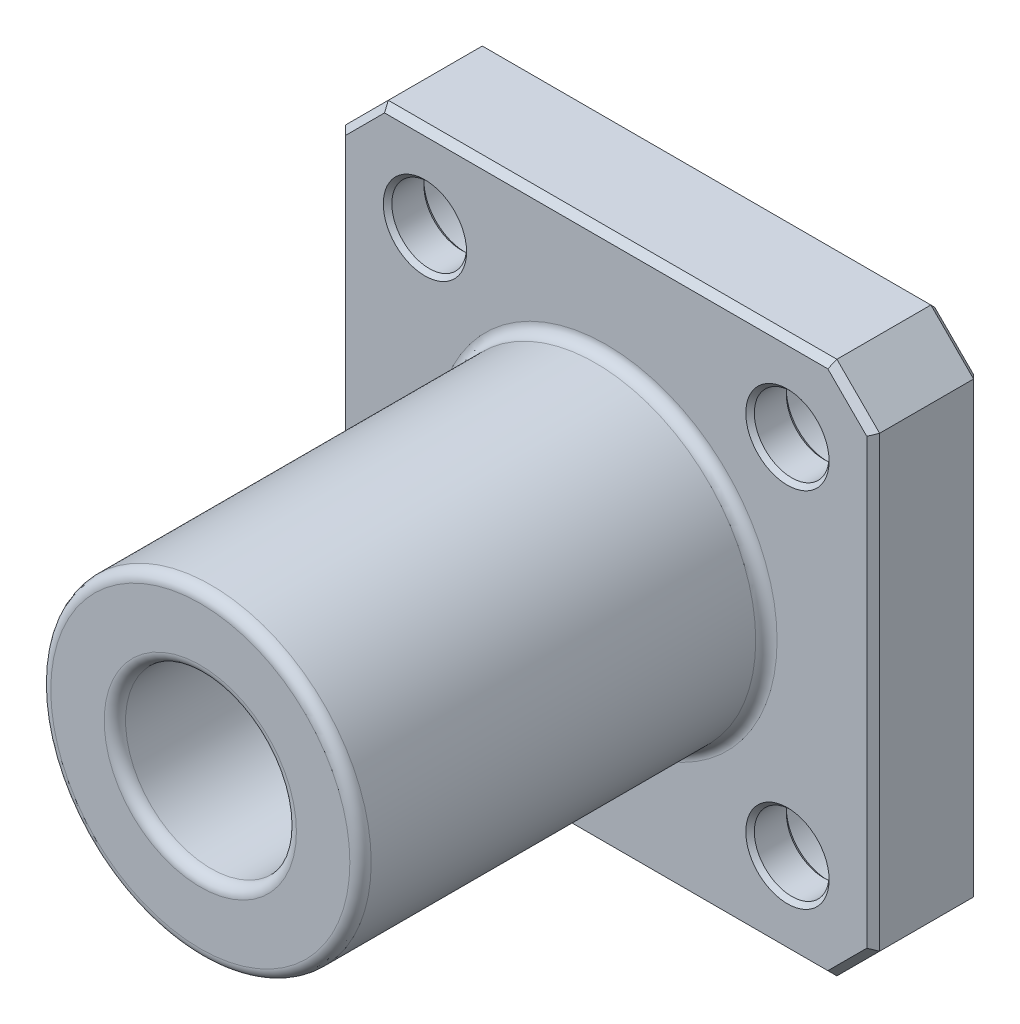
from build123d import *

# Parameters (mm, degrees)
SKETCH1_W                               = 25
SKETCH1_H                               = 25
SKETCH1_R                               = 4
BOSS_EXTRUDE1_DEPTH                     = 5
SKETCH2_R                               = 7.5
SKETCH2_R_2                             = 4
BOSS_EXTRUDE2_DEPTH                     = 19
CHAMFER1_SIZE                           = 2
CBORE_FOR_M3_PAN_HEAD_SCREW1_AT_2_COUNT = 2
CBORE_FOR_M3_PAN_HEAD_SCREW1_AT_2_PITCH = 16.970562748
CBORE_FOR_M3_PAN_HEAD_SCREW1_AT_3_COUNT = 2
CBORE_FOR_M3_PAN_HEAD_SCREW1_AT_3_PITCH = 24
CBORE_FOR_M3_PAN_HEAD_SCREW1_AT_4_COUNT = 2
CBORE_FOR_M3_PAN_HEAD_SCREW1_AT_4_PITCH = 16.970562748
CHAMFER2_SIZE                           = 0.3
FILLET1_R                               = 0.5
FILLET2_R                               = 0.5
CHAMFER3_SIZE                           = 0.3
FILLET3_R                               = 0.5
CHAMFER4_SIZE                           = 0.2


with BuildPart() as part:
    # Sketch1 → Boss-Extrude1 (new body)
    with BuildSketch(Plane.XY):
        Rectangle(SKETCH1_W, SKETCH1_H)
        Circle(SKETCH1_R, mode=Mode.SUBTRACT)
    extrude(amount=BOSS_EXTRUDE1_DEPTH)

    # Sketch2 → Boss-Extrude2 (add)
    with BuildSketch(Plane.XY.offset(5)):
        Circle(SKETCH2_R)
        Circle(SKETCH2_R_2, mode=Mode.SUBTRACT)
    extrude(amount=BOSS_EXTRUDE2_DEPTH)

    # Chamfer1
    chamfer1_edges = [part.edges().sort_by_distance(p)[0] for p in [
        (12.5, -12.5, 2.5),
        (-12.5, -12.5, 2.5),
        (-12.5, 12.5, 2.5),
        (12.5, 12.5, 2.5),
    ]]
    chamfer(chamfer1_edges, length=CHAMFER1_SIZE)

    # Sketch4 → CBORE for M3 Pan Head Screw1 (revolve, cut)
    with BuildSketch(Plane(origin=(8.485281374, 8.485281374, 0), x_dir=(0, 1, 0), z_dir=(1, 0, 0))):
        Polygon((0, 0), (0, 24), (1.75, 24), (1.75, 3.1), (3, 3.1), (3, 0.525), (3.525, 0), align=None)
    cbore_for_m3_pan_head_screw1 = revolve(axis=Axis((8.485281374, 8.485281374, -6.35), (0, 0, 1)), mode=Mode.SUBTRACT)

    # CBORE for M3 Pan Head Screw1 at 2: CBORE for M3 Pan Head Screw1 ×2
    with Locations(*[(-i * CBORE_FOR_M3_PAN_HEAD_SCREW1_AT_2_PITCH, 0, 0) for i in range(1, CBORE_FOR_M3_PAN_HEAD_SCREW1_AT_2_COUNT)]):
        add(cbore_for_m3_pan_head_screw1, mode=Mode.SUBTRACT)

    # CBORE for M3 Pan Head Screw1 at 3: CBORE for M3 Pan Head Screw1 ×2
    with Locations(*[Vector(-0.7071067811865676, -0.7071067811865276, 0) * (i * CBORE_FOR_M3_PAN_HEAD_SCREW1_AT_3_PITCH) for i in range(1, CBORE_FOR_M3_PAN_HEAD_SCREW1_AT_3_COUNT)]):
        add(cbore_for_m3_pan_head_screw1, mode=Mode.SUBTRACT)

    # CBORE for M3 Pan Head Screw1 at 4: CBORE for M3 Pan Head Screw1 ×2
    with Locations(*[(0, -i * CBORE_FOR_M3_PAN_HEAD_SCREW1_AT_4_PITCH, 0) for i in range(1, CBORE_FOR_M3_PAN_HEAD_SCREW1_AT_4_COUNT)]):
        add(cbore_for_m3_pan_head_screw1, mode=Mode.SUBTRACT)

    # Chamfer2
    chamfer2_edges = [part.edges().sort_by_distance(p)[0] for p in [
        (-12.5, 0, 0),
        (-12.5, 0, 5),
        (12.5, 0, 0),
        (0, -12.5, 0),
        (0, 12.5, 0),
        (11.5, 11.5, 0),
        (11.5, -11.5, 0),
        (-11.5, -11.5, 0),
        (-11.5, 11.5, 0),
        (0, 12.5, 5),
        (12.5, 0, 5),
        (0, -12.5, 5),
        (11.5, 11.5, 5),
        (11.5, -11.5, 5),
        (-11.5, -11.5, 5),
        (-11.5, 11.5, 5),
    ]]
    chamfer(chamfer2_edges, length=CHAMFER2_SIZE)

    # Fillet1
    fillet1_edges = [part.edges().sort_by_distance(p)[0] for p in [
        (-7.5, 0, 24),
    ]]
    fillet(fillet1_edges, radius=FILLET1_R)

    # Fillet2
    fillet2_edges = [part.edges().sort_by_distance(p)[0] for p in [
        (-4, 0, 24),
    ]]
    fillet(fillet2_edges, radius=FILLET2_R)

    # Chamfer3
    chamfer3_edges = [part.edges().sort_by_distance(p)[0] for p in [
        (-4, 0, 0),
    ]]
    chamfer(chamfer3_edges, length=CHAMFER3_SIZE)

    # Fillet3
    fillet3_edges = [part.edges().sort_by_distance(p)[0] for p in [
        (-7.5, 0, 5),
    ]]
    fillet(fillet3_edges, radius=FILLET3_R)

    # Chamfer4
    chamfer4_edges = [part.edges().sort_by_distance(p)[0] for p in [
        (8.485281374, -10.235281374, 5),
        (8.485281374, -10.235281374, 3.1),
        (-8.485281374, -10.235281374, 5),
        (-8.485281374, -10.235281374, 3.1),
        (-8.485281374, 6.735281374, 5),
        (-8.485281374, 6.735281374, 3.1),
        (8.485281374, 6.735281374, 5),
        (8.485281374, 6.735281374, 3.1),
    ]]
    chamfer(chamfer4_edges, length=CHAMFER4_SIZE)


solid = part.part
